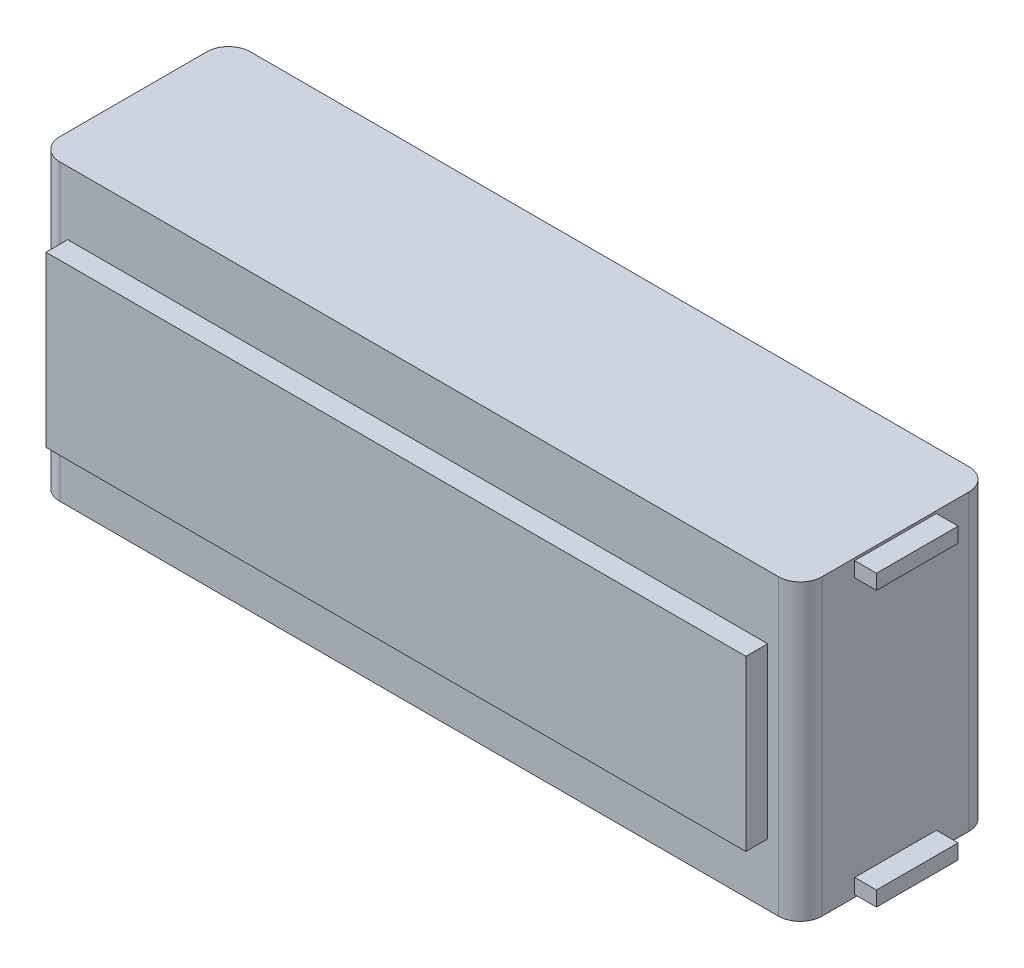
from build123d import *

# Parameters (mm, degrees)
SKETCH1_W           = 88.9
SKETCH1_H           = 34.29
BOSS_EXTRUDE1_DEPTH = 22.225
FILLET1_R           = 2.54
SKETCH2_W           = 9.52578488
SKETCH2_H           = 1.733476194
BOSS_EXTRUDE2_DEPTH = 2.54
SKETCH3_W           = 81.632090284
SKETCH3_H           = 19.709925483
BOSS_EXTRUDE3_DEPTH = 2.54


with BuildPart() as part:
    # Sketch1 → Boss-Extrude1 (new body)
    with BuildSketch(Plane.XY):
        Rectangle(SKETCH1_W, SKETCH1_H)
    extrude(amount=BOSS_EXTRUDE1_DEPTH)

    # Fillet1
    fillet1_edges = [part.edges().sort_by_distance(p)[0] for p in [
        (-44.45, 0, 22.225),
        (44.45, 0, 22.225),
        (-44.45, 0, 0),
        (44.45, 0, 0),
    ]]
    fillet(fillet1_edges, radius=FILLET1_R)

    # Sketch2 → Boss-Extrude2 (add)
    with BuildSketch(Plane(origin=(44.45, 0, 0), x_dir=(0, 0, -1), z_dir=(1, 0, 0))):
        with Locations((-11.1125, 15.996812485)):
            Rectangle(SKETCH2_W, SKETCH2_H)
    boss_extrude2 = extrude(amount=BOSS_EXTRUDE2_DEPTH)

    # Mirror1: Boss-Extrude2 across plane
    add(boss_extrude2.mirror(Plane.ZX))

    # Sketch3 → Boss-Extrude3 (add)
    with BuildSketch(Plane.XY.offset(22.225)):
        with Locations((-0.163591475, -0.108131836)):
            Rectangle(SKETCH3_W, SKETCH3_H)
    extrude(amount=BOSS_EXTRUDE3_DEPTH)


solid = part.part
